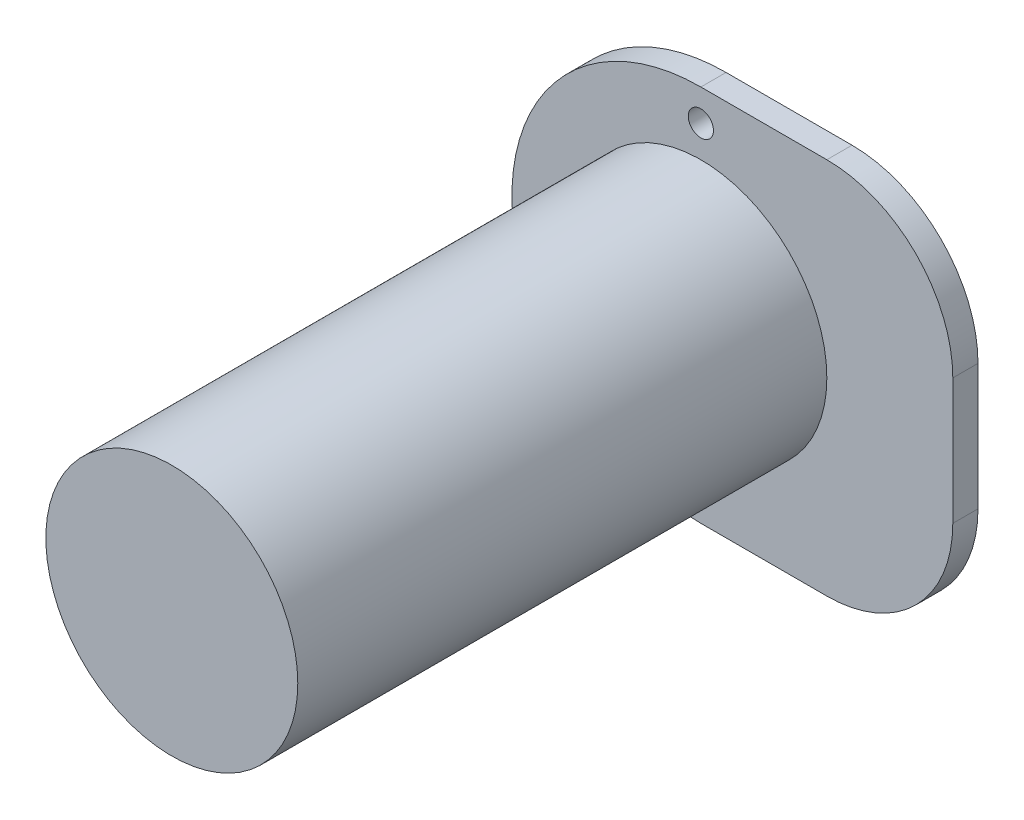
from build123d import *

# Parameters (mm, degrees)
SKETCH1_R           = 50
BOSS_EXTRUDE1_DEPTH = 105
BOSS_EXTRUDE2_DEPTH = 10
SKETCH3_R           = 5
CUT_EXTRUDE1_DEPTH  = 10
FILLET1_R           = 50


with BuildPart() as part:
    # Sketch1 → Boss-Extrude1 (new, symmetric)
    with BuildSketch(Plane.XY):
        Circle(SKETCH1_R)
    extrude(amount=BOSS_EXTRUDE1_DEPTH, both=True)

    # Sketch2 → Boss-Extrude2 (add)
    with BuildSketch(Plane(origin=(0, 0, -105), x_dir=(-1, 0, 0), z_dir=(0, 0, -1))):
        with BuildLine():
            Line((0, -75), (-100, -75))
            Line((-100, -75), (-100, 75))
            Line((-100, 75), (0, 75))
            ThreePointArc((0, 75), (75, 0), (0, -75))
        make_face()
    extrude(amount=BOSS_EXTRUDE2_DEPTH)

    # Sketch3 → Cut-Extrude1 (cut)
    with BuildSketch(Plane(origin=(0, 0, -115), x_dir=(-1, 0, 0), z_dir=(0, 0, -1))):
        with Locations((0, 62.5)):
            Circle(SKETCH3_R)
        with Locations((0, -62.5)):
            Circle(SKETCH3_R)
        with Locations((62.5, 0)):
            Circle(SKETCH3_R)
    extrude(amount=-CUT_EXTRUDE1_DEPTH, mode=Mode.SUBTRACT)

    # Fillet1
    fillet1_edges = [part.edges().sort_by_distance(p)[0] for p in [
        (100, 75, -110),
        (100, -75, -110),
    ]]
    fillet(fillet1_edges, radius=FILLET1_R)


solid = part.part
